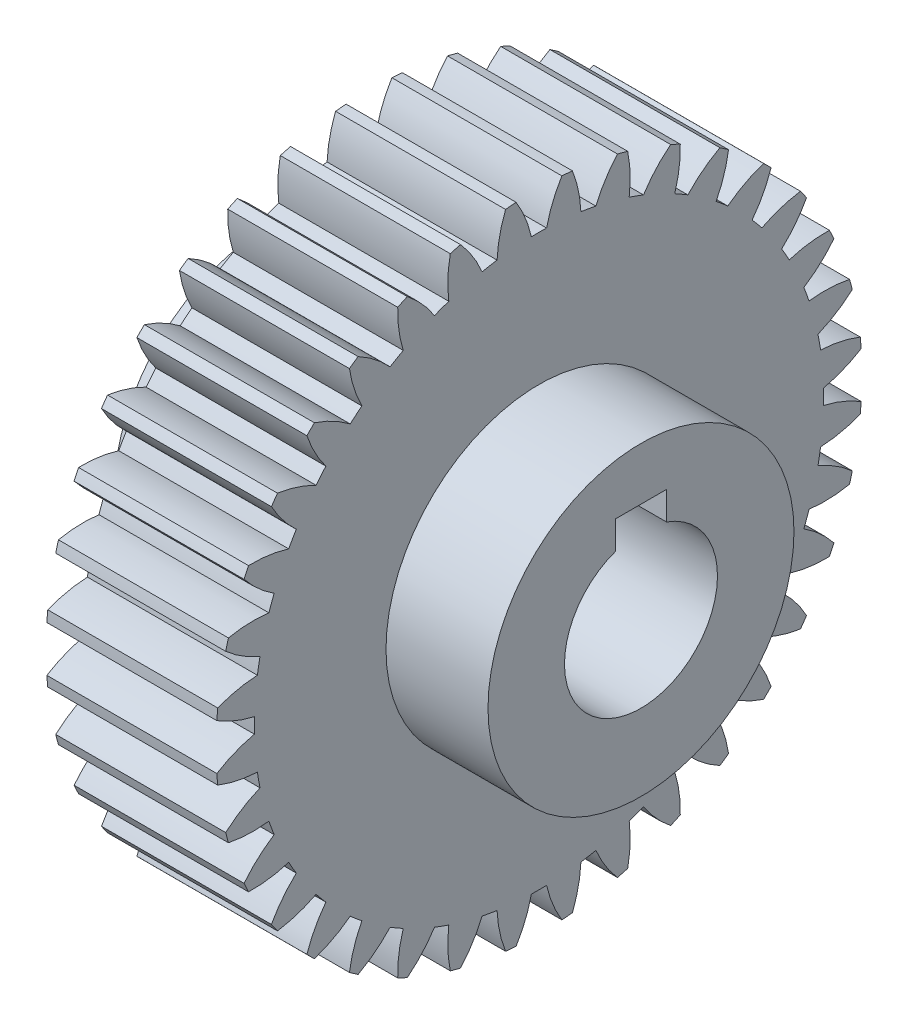
from build123d import *

# Parameters (mm, degrees)
BASPROSKE_W       = 20
BASPROSKE_H       = 38
TOOTHCUT_DEPTH    = 58.341084747
TEETHCUTS_COUNT   = 36
TEETHCUTS_ANGLE   = 350
HUBNEABOTSKE_R    = 18
HUBNEARBOTH_DEPTH = 12.0000254
HUBFAR_START      = 12.0000254
HUBFARSKE_R       = 18
HUBFAR_DEPTH      = 12.0000254
BORSKE_R          = 9
BORE_DEPTH        = 44.0000508
KEYSKE_W          = 6
KEYSKE_H          = 11.8
KEYWAY_DEPTH      = 44.0000508


with BuildPart() as part:
    # BasProSke → Base-Revolve (revolve)
    with BuildSketch(Plane(origin=(0, 0, 0), x_dir=(1, 0, 0), z_dir=(0, 1, 0))):
        with Locations((10, 19)):
            Rectangle(BASPROSKE_W, BASPROSKE_H)
    revolve(axis=Axis((-10, 0, 0), (1, 0, 0)))

    # TooCutSke → ToothCut (cut, through all)
    with BuildSketch(Plane(origin=(0, 0, 0), x_dir=(0, 0, -1), z_dir=(1, 0, 0))):
        with BuildLine():
            ThreePointArc((0.894889921, 33.487044854), (0, 33.499), (-0.894889921, 33.487044854))
            ThreePointArc((-0.894889921, 33.487044854), (-1.614211666, 35.783966241), (-2.706066289, 37.928989578))
            ThreePointArc((-2.706066289, 37.928989578), (0, 38.0254), (2.706066289, 37.928989578))
            ThreePointArc((2.706066289, 37.928989578), (1.614211666, 35.783966241), (0.894889921, 33.487044854))
        make_face()
    toothcut = extrude(amount=TOOTHCUT_DEPTH, mode=Mode.SUBTRACT)

    # TeethCuts: ToothCut ×36 about axis
    teethcuts_axis = Axis((-10, 0, 0), (1, 0, 0))
    for i in range(1, TEETHCUTS_COUNT):
        add(toothcut.rotate(teethcuts_axis, i * TEETHCUTS_ANGLE / (TEETHCUTS_COUNT - 1)), mode=Mode.SUBTRACT)

    # HubNeaBotSke → HubNearBoth (add)
    with BuildSketch(Plane.ZY):
        Circle(HUBNEABOTSKE_R)
    extrude(amount=HUBNEARBOTH_DEPTH)

    # HubFarSke → HubFar (add)
    with BuildSketch(Plane(origin=(20, 0, 0), x_dir=(0, 0, -1), z_dir=(1, 0, 0)).offset(HUBFAR_START)):
        Circle(HUBFARSKE_R)
    extrude(amount=-HUBFAR_DEPTH)

    # BorSke → Bore (cut, symmetric)
    with BuildSketch(Plane(origin=(0, 0, 0), x_dir=(0, 0, -1), z_dir=(1, 0, 0))):
        Circle(BORSKE_R)
    extrude(amount=BORE_DEPTH, both=True, mode=Mode.SUBTRACT)

    # KeySke → Keyway (cut, symmetric)
    with BuildSketch(Plane(origin=(0, 0, 0), x_dir=(0, 0, -1), z_dir=(1, 0, 0))):
        with Locations((0, 5.9)):
            Rectangle(KEYSKE_W, KEYSKE_H)
    extrude(amount=KEYWAY_DEPTH, both=True, mode=Mode.SUBTRACT)


solid = part.part
